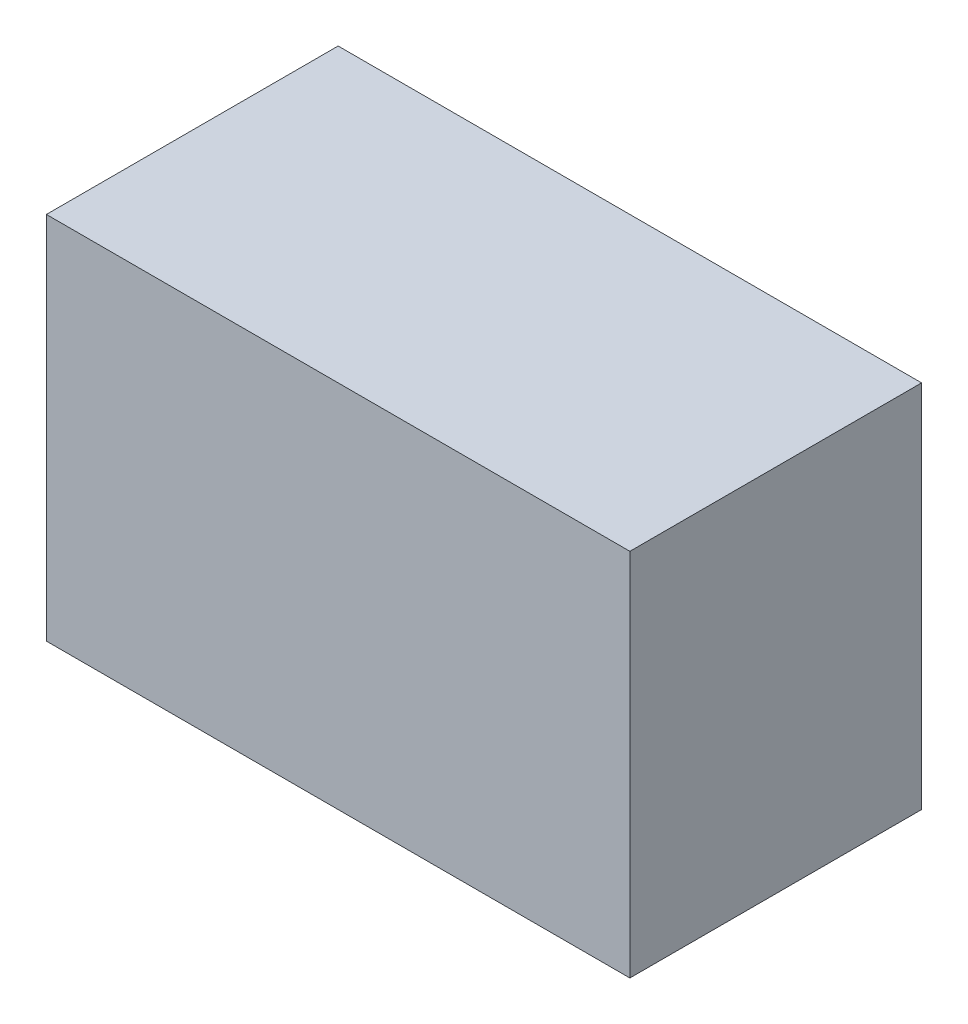
from build123d import *

# Parameters (mm, degrees)
ESQUISSE1_W          = 30
ESQUISSE1_H          = 19
BASE_EXTRUSION_DEPTH = 15


with BuildPart() as part:
    # Esquisse1 → Base-Extrusion (new body)
    with BuildSketch(Plane.XY):
        with Locations((15, 9.5)):
            Rectangle(ESQUISSE1_W, ESQUISSE1_H)
    extrude(amount=BASE_EXTRUSION_DEPTH)


solid = part.part
